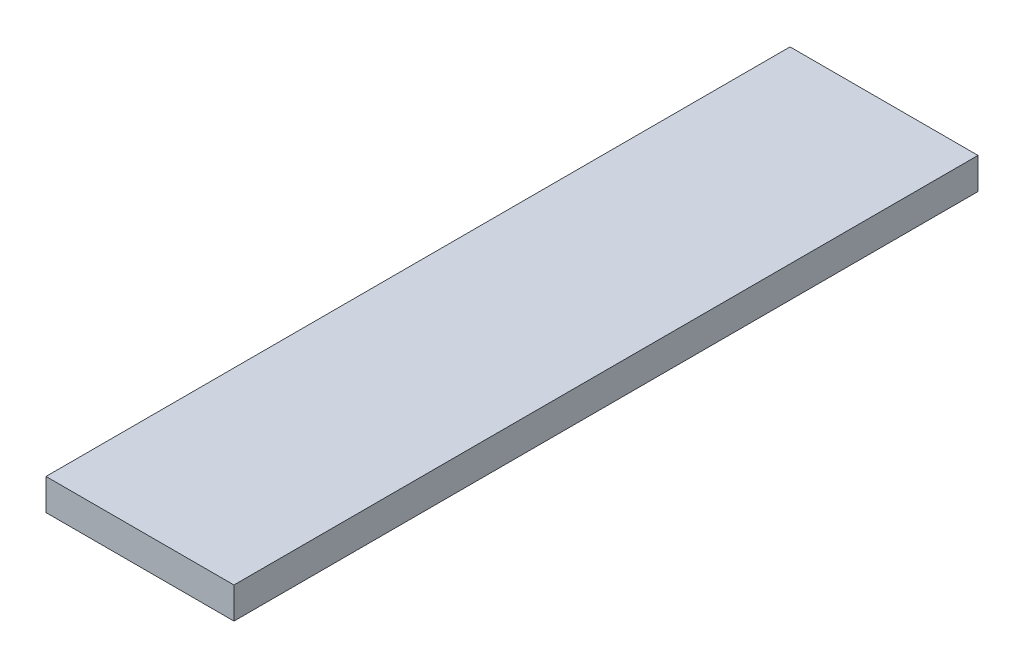
from build123d import *

# Parameters (mm, degrees)
SKETCH1_W           = 24
SKETCH1_H           = 95
BOSS_EXTRUDE1_DEPTH = 4


with BuildPart() as part:
    # Sketch1 → Boss-Extrude1 (new body)
    with BuildSketch(Plane(origin=(0, 0, 0), x_dir=(1, 0, 0), z_dir=(0, 1, 0))):
        with Locations((-10.954829401, -17.659044586)):
            Rectangle(SKETCH1_W, SKETCH1_H)
    extrude(amount=BOSS_EXTRUDE1_DEPTH)


solid = part.part
